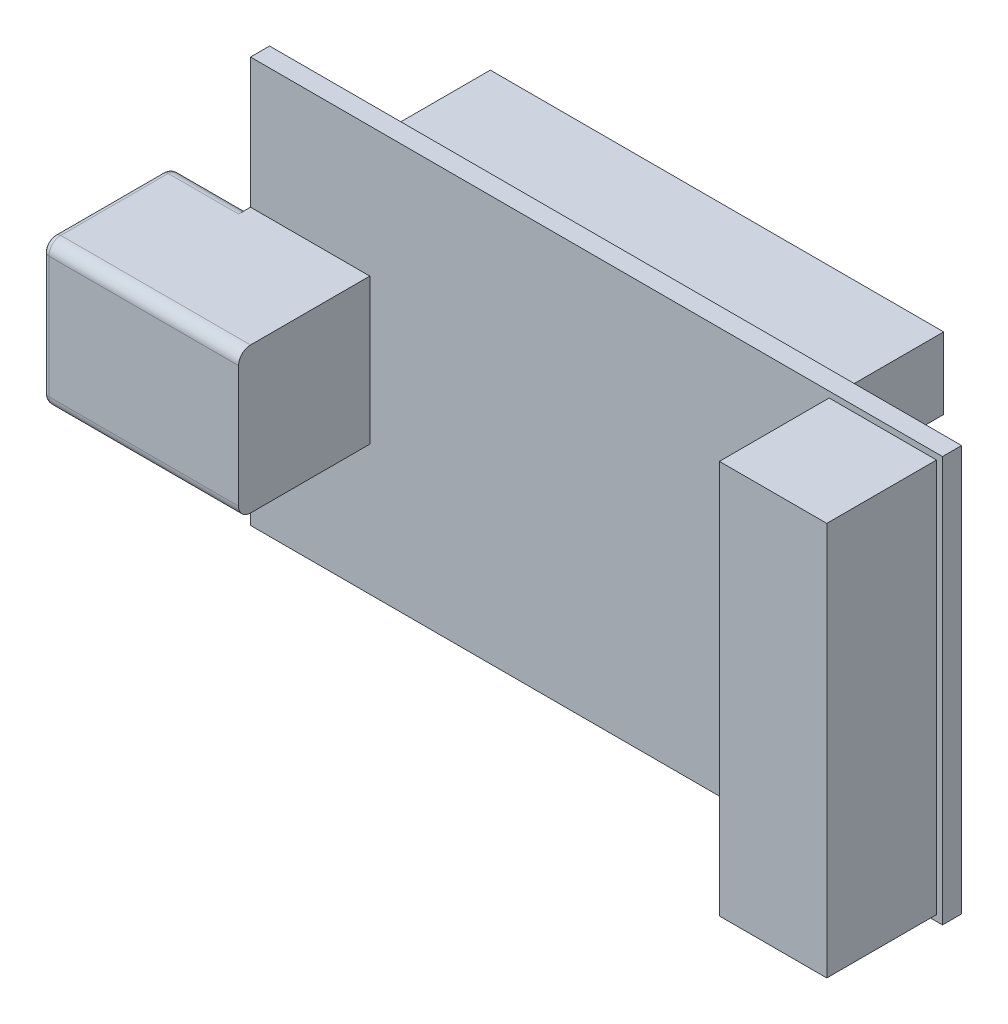
from build123d import *

# Parameters (mm, degrees)
SKETCH1_W          = 58
SKETCH1_H          = 34
EXTRUDE1_DEPTH     = 1.6
SKETCH2_W          = 38
SKETCH2_H          = 6
EXTRUDE2_DEPTH     = 8.5
SKETCH3_W          = 9
SKETCH3_H          = 33
EXTRUDE3_DEPTH     = 9.2
SKETCH4_W          = 16.4
SKETCH4_H          = 12.2
EXTRUDE4_DEPTH     = 11
CUT_EXTRUDE1_DEPTH = 14
FILLET1_R          = 1
FILLET2_R          = 0.5


with BuildPart() as part:
    # Sketch1 → Extrude1 (new body)
    with BuildSketch(Plane.XY):
        with Locations((29, 17)):
            Rectangle(SKETCH1_W, SKETCH1_H)
    extrude(amount=EXTRUDE1_DEPTH)

    # Sketch2 → Extrude2 (add)
    with BuildSketch(Plane(origin=(0, 0, 0), x_dir=(-1, 0, 0), z_dir=(0, 0, -1))):
        with Locations((-29, 30)):
            Rectangle(SKETCH2_W, SKETCH2_H)
        with Locations((-29, 4)):
            Rectangle(SKETCH2_W, SKETCH2_H)
    extrude(amount=EXTRUDE2_DEPTH)

    # Sketch3 → Extrude3 (add)
    with BuildSketch(Plane.XY.offset(1.6)):
        with Locations((53, 17)):
            Rectangle(SKETCH3_W, SKETCH3_H)
    extrude(amount=EXTRUDE3_DEPTH)

    # Sketch4 → Extrude4 (add)
    with BuildSketch(Plane.XY.offset(1.6)):
        with Locations((1.8, 17)):
            Rectangle(SKETCH4_W, SKETCH4_H)
    extrude(amount=EXTRUDE4_DEPTH)

    # Sketch5 → Cut-Extrude1 (cut)
    with BuildSketch(Plane.ZY.offset(6.4)):
        Polygon((8.8, 21.3), (10.8, 19.3), (10.8, 14.7), (8.8, 12.7), (3.4, 12.7), (3.4, 21.3), align=None)
    extrude(amount=-CUT_EXTRUDE1_DEPTH, mode=Mode.SUBTRACT)

    # Fillet1
    fillet1_edges = [part.edges().sort_by_distance(p)[0] for p in [
        (-3.2, 23.1, 1.6),
        (-3.2, 10.9, 1.6),
        (1.8, 23.1, 12.6),
        (1.8, 10.9, 12.6),
    ]]
    fillet(fillet1_edges, radius=FILLET1_R)

    # Fillet2
    fillet2_edges = [part.edges().sort_by_distance(p)[0] for p in [
        (-6.4, 21.3, 6.1),
        (-6.4, 17, 3.4),
        (-6.4, 12.7, 6.1),
        (-6.4, 13.7, 9.8),
        (-6.4, 17, 10.8),
        (-6.4, 20.3, 9.8),
        (-6.4, 17, 12.6),
        (-6.4, 10.9, 7.1),
        (-6.4, 17, 1.6),
        (-6.4, 23.1, 7.1),
        (-6.4, 22.807106781, 12.307106781),
        (-6.4, 22.807106781, 1.892893219),
        (-6.4, 11.192893219, 1.892893219),
        (-6.4, 11.192893219, 12.307106781),
    ]]
    fillet(fillet2_edges, radius=FILLET2_R)


solid = part.part
